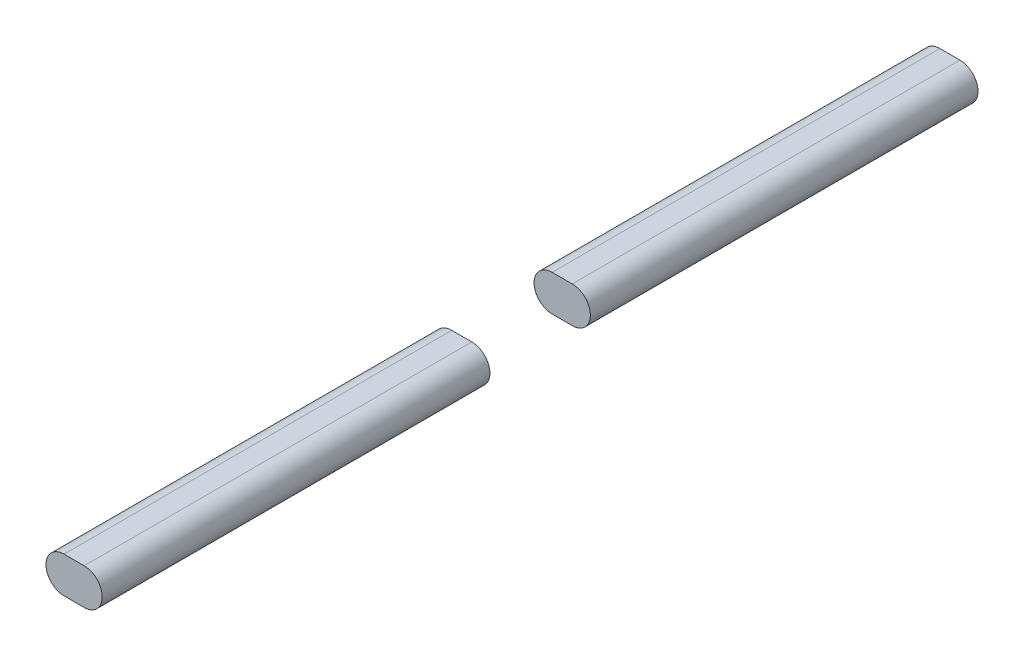
from build123d import *

# Parameters (mm, degrees)
EXTRUDE_START   = -12.5
EXTRUDE_1_DEPTH = 96.5
EXTRUDE_START_2 = 12.5
EXTRUDE_2_DEPTH = 96.5


with BuildPart() as part:
    # Эскиз1 → Бобышка-Вытянуть1 (new body)
    with BuildSketch(Plane.XY.offset(EXTRUDE_START)):
        with BuildLine():
            Line((-27.75, 0), (-22.75, 0))
            ThreePointArc((-22.75, 0), (-18.25, -4.5), (-22.75, -9))
            Line((-22.75, -9), (-27.75, -9))
            ThreePointArc((-27.75, -9), (-32.25, -4.5), (-27.75, 0))
        make_face()
    extrude(amount=-EXTRUDE_1_DEPTH)


with BuildPart() as body_2:
    # Эскиз1<2> → Бобышка-Вытянуть2 (new body)
    with BuildSketch(Plane.XY.offset(EXTRUDE_START_2)):
        with BuildLine():
            Line((-27.75, 0), (-22.75, 0))
            ThreePointArc((-22.75, 0), (-18.25, -4.5), (-22.75, -9))
            Line((-22.75, -9), (-27.75, -9))
            ThreePointArc((-27.75, -9), (-32.25, -4.5), (-27.75, 0))
        make_face()
    extrude(amount=EXTRUDE_2_DEPTH)


solid = Compound([part.part, body_2.part])
